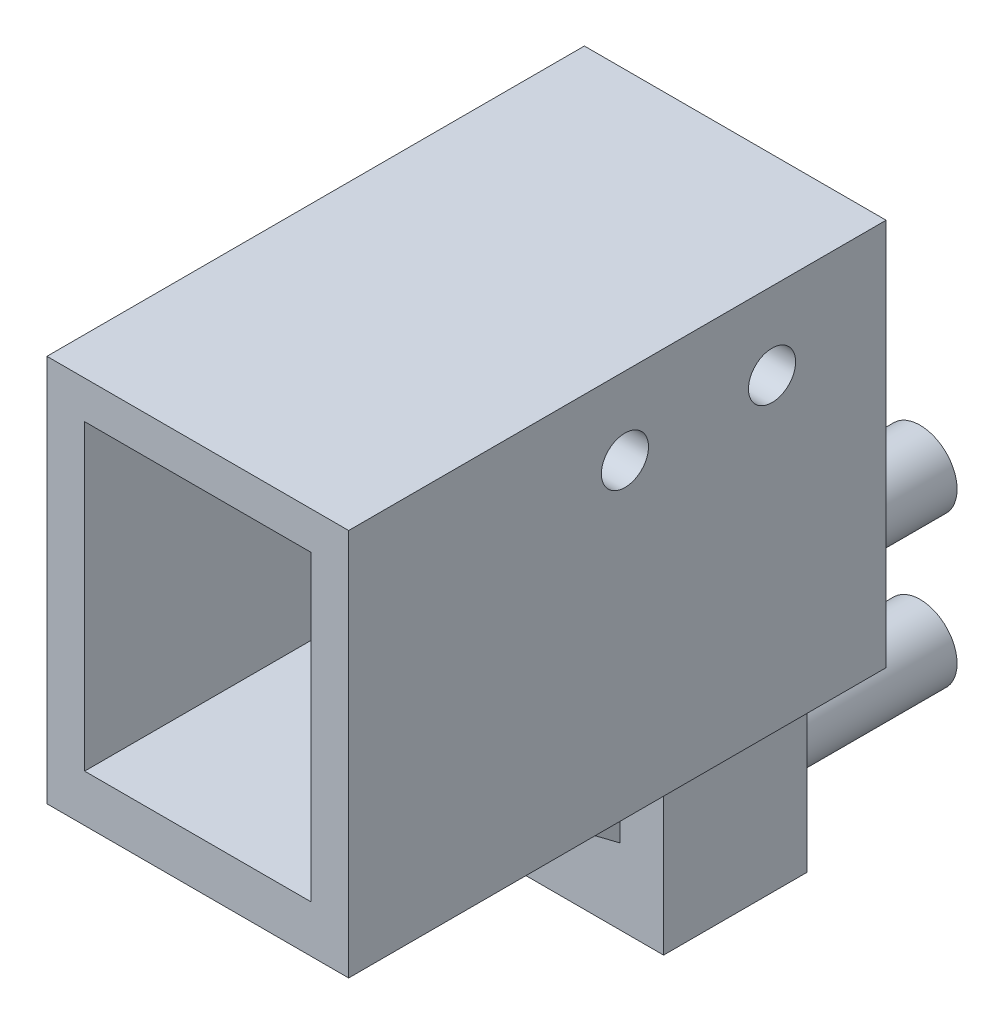
from build123d import *

# Parameters (mm, degrees)
SKETCH1_W               = 15.2
SKETCH1_H               = 15.2
BOSS_EXTRUDE1_DEPTH     = 14
SKETCH2_R               = 3.925
BOSS_EXTRUDE3_DEPTH     = 19.6
SKETCH3_W               = 32
SKETCH3_H               = 57
BOSS_EXTRUDE5_DEPTH     = 5
BOSS_EXTRUDE7_DEPTH     = 57
BOSS_EXTRUDE6_DEPTH     = 3
CUT_EXTRUDE1_DEPTH      = 73.155179994
CUT_EXTRUDE1_DEPTH_BACK = 73.155179994
SKETCH11_R              = 2.5


with BuildPart() as part:
    # Sketch1 → Boss-Extrude1 (new, symmetric)
    with BuildSketch(Plane(origin=(0, 0, 0), x_dir=(1, 0, 0), z_dir=(0, 1, 0))):
        Rectangle(SKETCH1_W, SKETCH1_H)
    extrude(amount=BOSS_EXTRUDE1_DEPTH, both=True)

    # Sketch2 → Boss-Extrude3 (add)
    with BuildSketch(Plane.XY.offset(-7.6)):
        with Locations((0, -6.45)):
            Circle(SKETCH2_R)
        with Locations((0, 9.55)):
            Circle(SKETCH2_R)
    extrude(amount=-BOSS_EXTRUDE3_DEPTH)

    # Sketch3 → Boss-Extrude5 (add)
    with BuildSketch(Plane(origin=(0, 14, 0), x_dir=(1, 0, 0), z_dir=(0, 1, 0))):
        with Locations((0, -20.9)):
            Rectangle(SKETCH3_W, SKETCH3_H)
    extrude(amount=-BOSS_EXTRUDE5_DEPTH)

    # Sketch9 → Boss-Extrude7 (add)
    with BuildSketch(Plane(origin=(0, 0, -7.6), x_dir=(-1, 0, 0), z_dir=(0, 0, -1))):
        Polygon((-16, 46.1), (-16, 14), (-12, 14), (-12, 46.1), (12, 46.1), (12, 14), (16, 14), (16, 50.1), (-16, 50.1), align=None)
    extrude(amount=-BOSS_EXTRUDE7_DEPTH)

    # Sketch5 → Boss-Extrude6 (add, symmetric)
    with BuildSketch(Plane(origin=(0, 0, 0), x_dir=(0, 0, -1), z_dir=(1, 0, 0))):
        Polygon((-7.6, -6), (-7.6, 9), (-27.6, 9), align=None)
    extrude(amount=BOSS_EXTRUDE6_DEPTH, both=True)

    # Sketch11 → Cut-Extrude1 (cut, two sides: drawn at the far end of the back side and taken through both)
    with BuildSketch(Plane(origin=(0, 0, 0), x_dir=(0, 0, -1), z_dir=(1, 0, 0)).offset(-CUT_EXTRUDE1_DEPTH_BACK)):
        with Locations((-20.1, 41.9)):
            Circle(SKETCH11_R)
        with Locations((-4.5, 41.9)):
            Circle(SKETCH11_R)
    extrude(amount=CUT_EXTRUDE1_DEPTH + CUT_EXTRUDE1_DEPTH_BACK, mode=Mode.SUBTRACT)


solid = part.part
